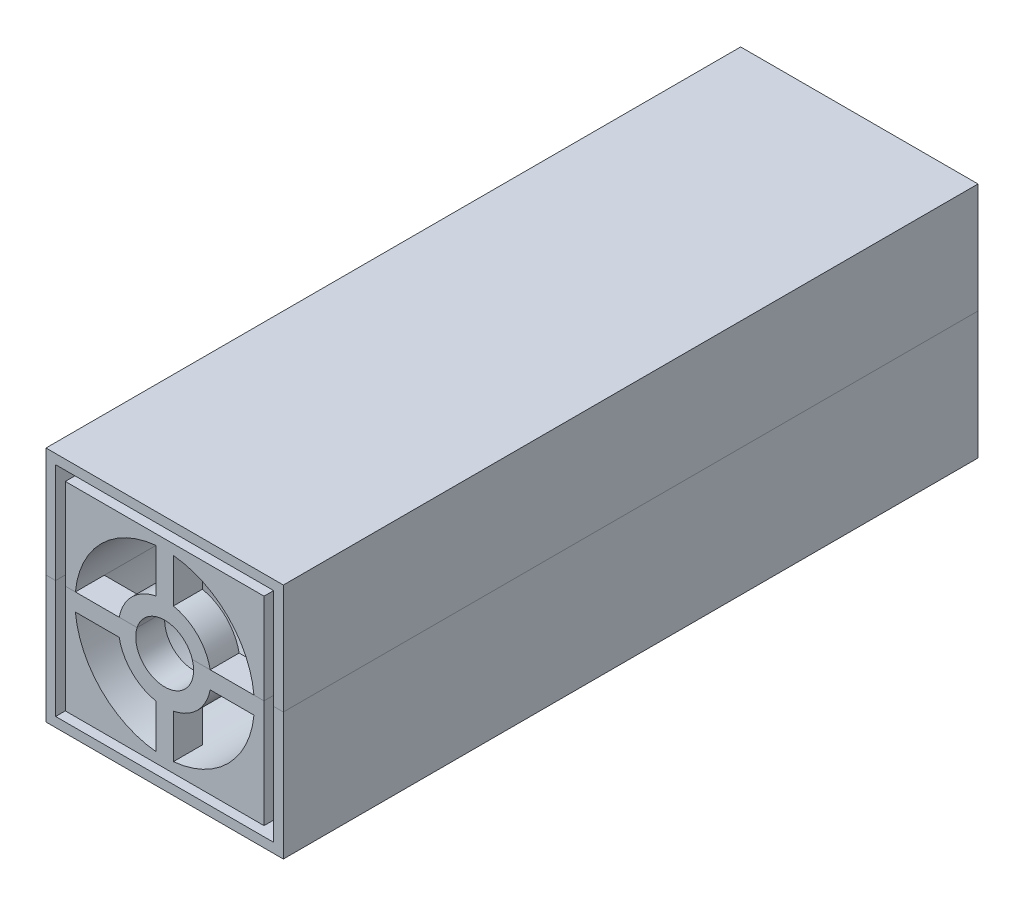
from build123d import *

# Parameters (mm, degrees)
SKETCH2_W           = 52.07
SKETCH2_H           = 52.07
BOSS_EXTRUDE1_DEPTH = 152.4
SKETCH3_W           = 47.8366836
SKETCH3_H           = 47.8366836
SKETCH3_W_2         = 43.6035196
SKETCH3_H_2         = 43.6035196
CUT_EXTRUDE1_DEPTH  = 12.7
SKETCH4_R           = 19.685
CUT_EXTRUDE2_DEPTH  = 146.05
BOSS_EXTRUDE2_DEPTH = 6.35
SKETCH6_R           = 6.35
CUT_EXTRUDE3_DEPTH  = 157.78457338
SKETCH7_W           = 39.37
SKETCH7_H           = 25.4
CUT_EXTRUDE4_DEPTH  = 26.035


with BuildPart() as part:
    # Sketch2 → Boss-Extrude1 (new body)
    with BuildSketch(Plane.XY):
        Rectangle(SKETCH2_W, SKETCH2_H)
    extrude(amount=-BOSS_EXTRUDE1_DEPTH)

    # Sketch3 → Cut-Extrude1 (cut)
    with BuildSketch(Plane.XY):
        Rectangle(SKETCH3_W, SKETCH3_H)
        Rectangle(SKETCH3_W_2, SKETCH3_H_2, mode=Mode.SUBTRACT)
    extrude(amount=-CUT_EXTRUDE1_DEPTH, mode=Mode.SUBTRACT)

    # Sketch4 → Cut-Extrude2 (cut)
    with BuildSketch(Plane.XY):
        Circle(SKETCH4_R)
    extrude(amount=-CUT_EXTRUDE2_DEPTH, mode=Mode.SUBTRACT)

    # Sketch5 → Boss-Extrude2 (add)
    with BuildSketch(Plane.XY):
        with BuildLine():
            ThreePointArc((-19.592605748, -1.905), (-19.685, 0), (-19.592605748, 1.905))
            Line((-19.592605748, 1.905), (-21.8017598, 1.905))
            Line((-21.8017598, 1.905), (-21.8017598, -1.905))
            Line((-21.8017598, -1.905), (-19.592605748, -1.905))
        make_face()
        with BuildLine():
            Line((-9.979808365, 1.905), (-19.592605748, 1.905))
            ThreePointArc((-19.592605748, 1.905), (-19.685, 0), (-19.592605748, -1.905))
            Line((-19.592605748, -1.905), (-9.979808365, -1.905))
            ThreePointArc((-9.979808365, -1.905), (-10.16, 0), (-9.979808365, 1.905))
        make_face()
        with BuildLine():
            Line((-1.905, -1.905), (-1.905, 1.905))
            Line((-1.905, 1.905), (-9.979808365, 1.905))
            ThreePointArc((-9.979808365, 1.905), (-10.16, 0), (-9.979808365, -1.905))
            Line((-9.979808365, -1.905), (-1.905, -1.905))
        make_face()
        with BuildLine():
            Line((-1.905, -9.979808365), (-1.905, -1.905))
            Line((-1.905, -1.905), (-9.979808365, -1.905))
            ThreePointArc((-9.979808365, -1.905), (-7.184204897, -7.184204897), (-1.905, -9.979808365))
        make_face()
        with BuildLine():
            Line((1.905, -1.905), (-1.905, -1.905))
            Line((-1.905, -1.905), (-1.905, -9.979808365))
            ThreePointArc((-1.905, -9.979808365), (0, -10.16), (1.905, -9.979808365))
            Line((1.905, -9.979808365), (1.905, -1.905))
        make_face()
        with BuildLine():
            Line((9.979808365, -1.905), (1.905, -1.905))
            Line((1.905, -1.905), (1.905, -9.979808365))
            ThreePointArc((1.905, -9.979808365), (7.184204897, -7.184204897), (9.979808365, -1.905))
        make_face()
        with BuildLine():
            Line((9.979808365, 1.905), (1.905, 1.905))
            Line((1.905, 1.905), (1.905, -1.905))
            Line((1.905, -1.905), (9.979808365, -1.905))
            ThreePointArc((9.979808365, -1.905), (10.114851778, -0.956751538), (10.16, 0))
            ThreePointArc((10.16, 0), (10.114851778, 0.956751538), (9.979808365, 1.905))
        make_face()
        with BuildLine():
            ThreePointArc((9.979808365, 1.905), (7.184204897, 7.184204897), (1.905, 9.979808365))
            Line((1.905, 9.979808365), (1.905, 1.905))
            Line((1.905, 1.905), (9.979808365, 1.905))
        make_face()
        with BuildLine():
            ThreePointArc((1.905, 9.979808365), (0, 10.16), (-1.905, 9.979808365))
            Line((-1.905, 9.979808365), (-1.905, 1.905))
            Line((-1.905, 1.905), (1.905, 1.905))
            Line((1.905, 1.905), (1.905, 9.979808365))
        make_face()
        with BuildLine():
            Line((-1.905, 1.905), (-1.905, 9.979808365))
            ThreePointArc((-1.905, 9.979808365), (-7.184204897, 7.184204897), (-9.979808365, 1.905))
            Line((-9.979808365, 1.905), (-1.905, 1.905))
        make_face()
        with BuildLine():
            ThreePointArc((1.905, 19.592605748), (0, 19.685), (-1.905, 19.592605748))
            Line((-1.905, 19.592605748), (-1.905, 9.979808365))
            ThreePointArc((-1.905, 9.979808365), (0, 10.16), (1.905, 9.979808365))
            Line((1.905, 9.979808365), (1.905, 19.592605748))
        make_face()
        with BuildLine():
            Line((1.905, 21.8017598), (-1.905, 21.8017598))
            Line((-1.905, 21.8017598), (-1.905, 19.592605748))
            ThreePointArc((-1.905, 19.592605748), (0, 19.685), (1.905, 19.592605748))
            Line((1.905, 19.592605748), (1.905, 21.8017598))
        make_face()
        with BuildLine():
            ThreePointArc((19.685, 0), (19.661887869, 0.953619643), (19.592605748, 1.905))
            Line((19.592605748, 1.905), (9.979808365, 1.905))
            ThreePointArc((9.979808365, 1.905), (10.114851778, 0.956751538), (10.16, 0))
            ThreePointArc((10.16, 0), (10.114851778, -0.956751538), (9.979808365, -1.905))
            Line((9.979808365, -1.905), (19.592605748, -1.905))
            ThreePointArc((19.592605748, -1.905), (19.661887869, -0.953619643), (19.685, 0))
        make_face()
        with BuildLine():
            Line((21.8017598, 1.905), (19.592605748, 1.905))
            ThreePointArc((19.592605748, 1.905), (19.661887869, 0.953619643), (19.685, 0))
            ThreePointArc((19.685, 0), (19.661887869, -0.953619643), (19.592605748, -1.905))
            Line((19.592605748, -1.905), (21.8017598, -1.905))
            Line((21.8017598, -1.905), (21.8017598, 1.905))
        make_face()
        with BuildLine():
            Line((-1.905, -9.979808365), (-1.905, -19.592605748))
            ThreePointArc((-1.905, -19.592605748), (0, -19.685), (1.905, -19.592605748))
            Line((1.905, -19.592605748), (1.905, -9.979808365))
            ThreePointArc((1.905, -9.979808365), (0, -10.16), (-1.905, -9.979808365))
        make_face()
        with BuildLine():
            ThreePointArc((1.905, -19.592605748), (0, -19.685), (-1.905, -19.592605748))
            Line((-1.905, -19.592605748), (-1.905, -21.8017598))
            Line((-1.905, -21.8017598), (1.905, -21.8017598))
            Line((1.905, -21.8017598), (1.905, -19.592605748))
        make_face()
    extrude(amount=-BOSS_EXTRUDE2_DEPTH)

    # Sketch6 → Cut-Extrude3 (cut, through all)
    with BuildSketch(Plane.XY):
        Circle(SKETCH6_R)
    extrude(amount=-CUT_EXTRUDE3_DEPTH, mode=Mode.SUBTRACT)

    # Sketch7 → Cut-Extrude4 (cut)
    with BuildSketch(Plane.XZ.offset(26.035)):
        with Locations((0, -133.35)):
            Rectangle(SKETCH7_W, SKETCH7_H)
    extrude(amount=-CUT_EXTRUDE4_DEPTH, mode=Mode.SUBTRACT)


with BuildPart() as body_2:
    # Split1: the piece on the far side of the plane
    add(part.part)
    split(bisect_by=Plane.ZX.offset(1.905), keep=Keep.BOTTOM)


with BuildPart() as part_1:
    add(part.part)

    # Split1
    split(bisect_by=Plane.ZX.offset(1.905), keep=Keep.TOP)


solid = Compound([body_2.part, part_1.part])
